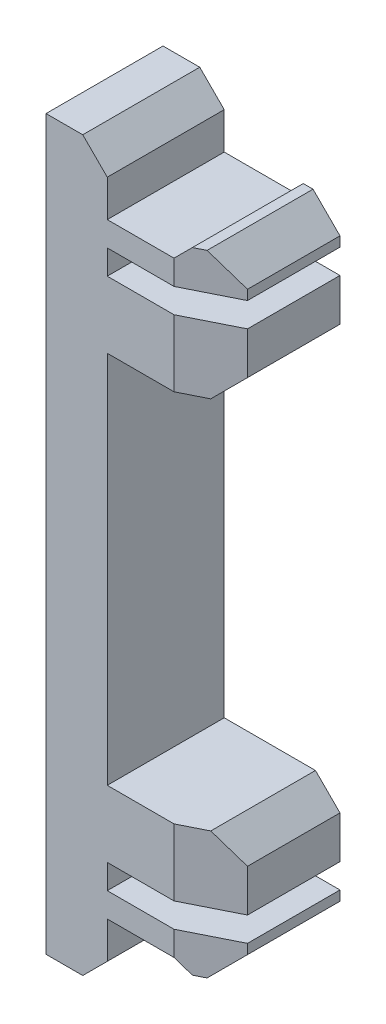
from build123d import *

# Parameters (mm, degrees)
BOSS_EXTRUDE1_DEPTH             = 3.032500031
BOSS_EXTRUDE2_REACH             = 21.66
BOSS_EXTRUDE2_DIRECTION_2_REACH = 21.66
CUT_EXTRUDE1_DEPTH              = 30.099344278


with BuildPart() as part:
    # Sketch1 → Boss-Extrude1 (new, symmetric)
    with BuildSketch(Plane.XY):
        Polygon((-2.682499969, -18.875), (-4.587499969, -18.875), (-4.587499969, 18.875), (-2.682499969, 18.875), (-1.412499969, 17.605), (-1.412499969, -17.605), align=None)
    extrude(amount=BOSS_EXTRUDE1_DEPTH, both=True)

    # Boss-Extrude2: up to this face of the body (flat: up to its plane)
    boss_extrude2_end = Plane(part.part.faces().sort_by_distance((-3.0158798, 0, 3.032500031))[0])
    # Sketch1<3> → Boss-Extrude2 (add, up to the picked face)
    with BuildSketch(Plane.XY, mode=Mode.PRIVATE) as boss_extrude2_sk1:
        Polygon((-1.412499969, 13.16), (-1.412499969, 9.7), (3.317499969, 9.7), (4.587499969, 10.97), (4.587499969, 13.16), align=None)
    boss_extrude2_tool1 = split(extrude(boss_extrude2_sk1.sketch, amount=BOSS_EXTRUDE2_REACH, mode=Mode.PRIVATE), bisect_by=boss_extrude2_end, keep=Keep.BOTH, mode=Mode.PRIVATE)
    # Sketch1<3> → Boss-Extrude2 (add, up to the picked face)
    with BuildSketch(Plane.XY, mode=Mode.PRIVATE) as boss_extrude2_sk2:
        Polygon((-1.412499969, 15.7), (-1.412499969, 14.43), (4.587499969, 14.43), (4.587499969, 14.938), (3.190499969, 16.335), (2.682499969, 16.335), (2.047499969, 15.7), align=None)
    boss_extrude2_tool2 = split(extrude(boss_extrude2_sk2.sketch, amount=BOSS_EXTRUDE2_REACH, mode=Mode.PRIVATE), bisect_by=boss_extrude2_end, keep=Keep.BOTH, mode=Mode.PRIVATE)
    add(boss_extrude2_tool1.solids().sort_by(Axis((1.48336, 11.482811, 0), (0, 0, 1)))[0])
    add(boss_extrude2_tool2.solids().sort_by(Axis((1.610079, 15.131792, 0), (0, 0, 1)))[0])

    # Boss-Extrude2 direction 2: up to this face of the body (flat: up to its plane)
    boss_extrude2_direction_2_end = Plane(part.part.faces().sort_by_distance((-3.0158798, 0, -3.032500031))[0])
    # Sketch1<3> → Boss-Extrude2 direction 2 (add, up to the picked face)
    with BuildSketch(Plane.XY, mode=Mode.PRIVATE) as boss_extrude2_direction_2_sk1:
        Polygon((-1.412499969, 13.16), (-1.412499969, 9.7), (3.317499969, 9.7), (4.587499969, 10.97), (4.587499969, 13.16), align=None)
    boss_extrude2_direction_2_tool1 = split(extrude(boss_extrude2_direction_2_sk1.sketch, amount=-BOSS_EXTRUDE2_DIRECTION_2_REACH, mode=Mode.PRIVATE), bisect_by=boss_extrude2_direction_2_end, keep=Keep.BOTH, mode=Mode.PRIVATE)
    # Sketch1<3> → Boss-Extrude2 direction 2 (add, up to the picked face)
    with BuildSketch(Plane.XY, mode=Mode.PRIVATE) as boss_extrude2_direction_2_sk2:
        Polygon((-1.412499969, 15.7), (-1.412499969, 14.43), (4.587499969, 14.43), (4.587499969, 14.938), (3.190499969, 16.335), (2.682499969, 16.335), (2.047499969, 15.7), align=None)
    boss_extrude2_direction_2_tool2 = split(extrude(boss_extrude2_direction_2_sk2.sketch, amount=-BOSS_EXTRUDE2_DIRECTION_2_REACH, mode=Mode.PRIVATE), bisect_by=boss_extrude2_direction_2_end, keep=Keep.BOTH, mode=Mode.PRIVATE)
    add(boss_extrude2_direction_2_tool1.solids().sort_by(Axis((1.48336, 11.482811, 0), (0, 0, -1)))[0])
    add(boss_extrude2_direction_2_tool2.solids().sort_by(Axis((1.610079, 15.131792, 0), (0, 0, -1)))[0])

    # Sketch2 → Cut-Extrude1 (cut, through all)
    with BuildSketch(Plane.XZ.offset(-9.7)):
        Polygon((2.047499969, 3.032500031), (4.587499969, 1.762500031), (4.587499969, 3.032500031), align=None)
    extrude(amount=-CUT_EXTRUDE1_DEPTH, mode=Mode.SUBTRACT)

    # Mirror2: part across plane


with BuildPart() as part_1:
    add(part.part)
    add(part.part.mirror(Plane.ZX))


solid = part_1.part
